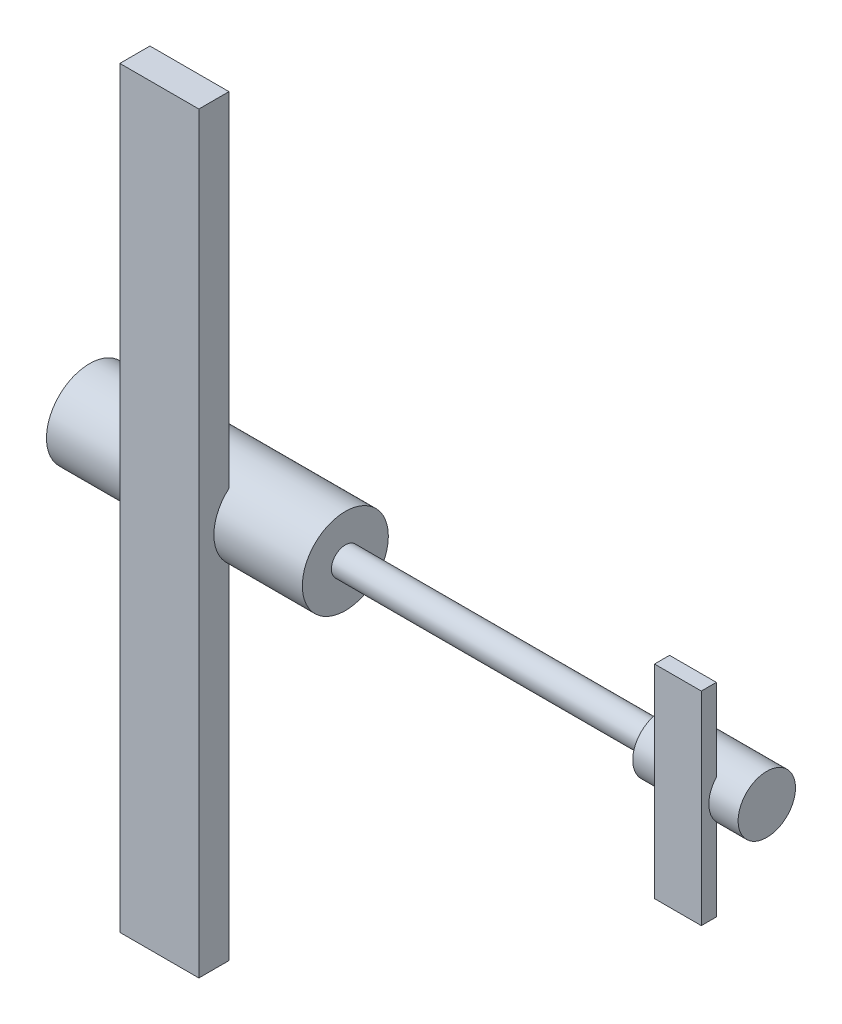
from build123d import *

# Parameters (mm, degrees)
SKETCH2_R           = 57.15
BOSS_EXTRUDE1_DEPTH = 340
SKETCH3_R           = 18.53927994
BOSS_EXTRUDE2_DEPTH = 420
SKETCH4_R           = 38.1
BOSS_EXTRUDE3_DEPTH = 140
SKETCH5_W           = 105
SKETCH5_H           = 40
BOSS_EXTRUDE4_DEPTH = 500
SKETCH6_W           = 62.2
SKETCH6_H           = 20
BOSS_EXTRUDE5_DEPTH = 135


with BuildPart() as part:
    # Sketch2 → Boss-Extrude1 (new body)
    with BuildSketch(Plane.YZ):
        with Locations(Location((0, 0, 0), (0, 0, 270))):
            Circle(SKETCH2_R)
    extrude(amount=BOSS_EXTRUDE1_DEPTH)

    # Sketch3 → Boss-Extrude2 (add)
    with BuildSketch(Plane.YZ.offset(340)):
        with Locations(Location((0, 0, 0), (0, 0, 270))):
            Circle(SKETCH3_R)
    extrude(amount=BOSS_EXTRUDE2_DEPTH)

    # Sketch4 → Boss-Extrude3 (add)
    with BuildSketch(Plane.YZ.offset(760)):
        with Locations(Location((0, 0, 0), (0, 0, 270))):
            Circle(SKETCH4_R)
    extrude(amount=BOSS_EXTRUDE3_DEPTH)

    # Sketch5 → Boss-Extrude4 (add, symmetric)
    with BuildSketch(Plane(origin=(0, 0, 0), x_dir=(-1, 0, 0), z_dir=(0, 1, 0))):
        with Locations((-170, 57.15)):
            Rectangle(SKETCH5_W, SKETCH5_H)
    extrude(amount=BOSS_EXTRUDE4_DEPTH, both=True)

    # Sketch6 → Boss-Extrude5 (add, symmetric)
    with BuildSketch(Plane(origin=(0, 0, 0), x_dir=(-1, 0, 0), z_dir=(0, 1, 0))):
        with Locations((-830, 38.1)):
            Rectangle(SKETCH6_W, SKETCH6_H)
    extrude(amount=BOSS_EXTRUDE5_DEPTH, both=True)


solid = part.part
